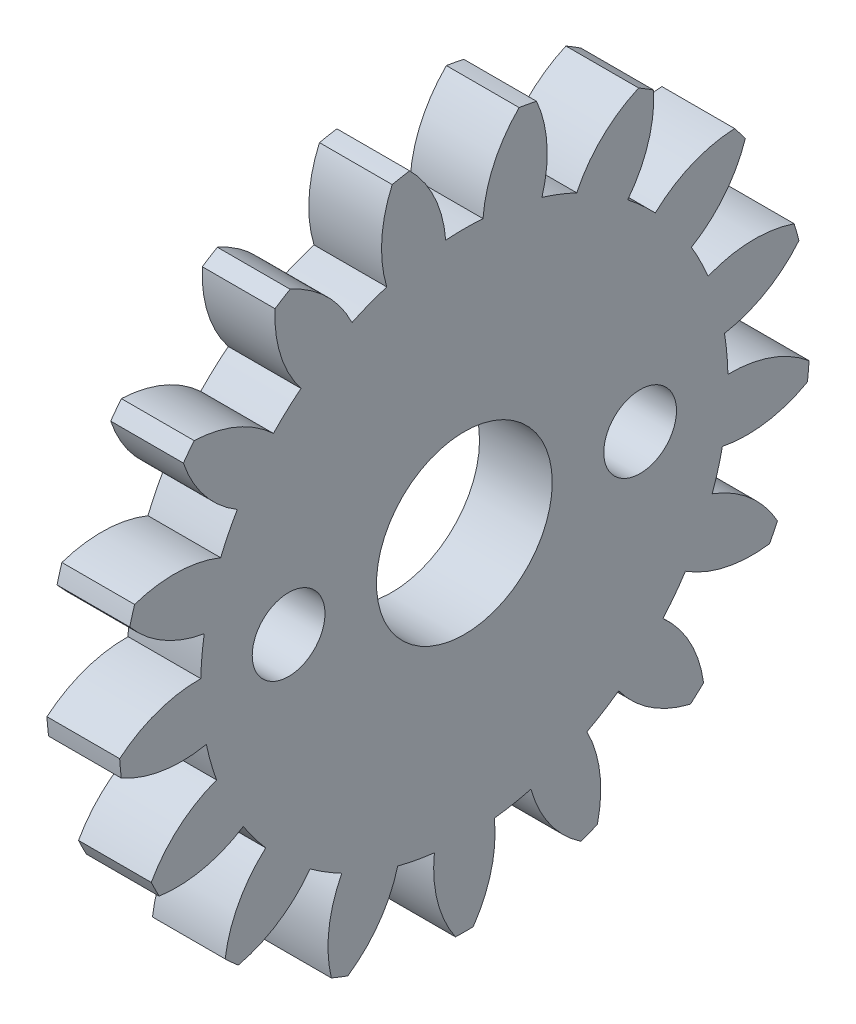
from build123d import *

# Parameters (mm, degrees)
BASPROSKE_W           = 3
BASPROSKE_H           = 14.25
TOOTHCUT_DEPTH        = 21.374616561
TEETHCUTS_COUNT       = 17
TEETHCUTS_ANGLE       = 338.823529412
BORSKE_R              = 2.5
BORE_DEPTH            = 50.0000508
CROQUIS1_R            = 1.5
CROQUIS1_R_2          = 3.625
CORTAR_EXTRUIR1_DEPTH = 10


with BuildPart() as part:
    # BasProSke → Base-Revolve (revolve)
    with BuildSketch(Plane(origin=(0, 0, 0), x_dir=(1, 0, 0), z_dir=(0, 1, 0)), mode=Mode.PRIVATE) as base_revolve_sk:
        with Locations((1.5, 7.125)):
            Rectangle(BASPROSKE_W, BASPROSKE_H)
    revolve(base_revolve_sk.sketch.rotate(Axis((-10, 0, 0), (1, 0, 0)), 180), axis=Axis((-10, 0, 0), (1, 0, 0)))

    # TooCutSke → ToothCut (cut, through all)
    with BuildSketch(Plane(origin=(0, 0, 0), x_dir=(0, 0, -1), z_dir=(1, 0, 0))):
        with BuildLine():
            ThreePointArc((0.769354207, 10.846749287), (0, 10.874), (-0.769354207, 10.846749287))
            ThreePointArc((-0.769354207, 10.846749287), (-1.230849554, 12.606357238), (-2.280560064, 14.092057726))
            ThreePointArc((-2.280560064, 14.092057726), (0, 14.2754), (2.280560064, 14.092057726))
            ThreePointArc((2.280560064, 14.092057726), (1.230849554, 12.606357238), (0.769354207, 10.846749287))
        make_face()
    toothcut = extrude(amount=TOOTHCUT_DEPTH, mode=Mode.SUBTRACT)

    # TeethCuts: ToothCut ×17 about axis
    teethcuts_axis = Axis((-10, 0, 0), (1, 0, 0))
    for i in range(1, TEETHCUTS_COUNT):
        add(toothcut.rotate(teethcuts_axis, i * TEETHCUTS_ANGLE / (TEETHCUTS_COUNT - 1)), mode=Mode.SUBTRACT)

    # BorSke → Bore (cut, symmetric)
    with BuildSketch(Plane(origin=(0, 0, 0), x_dir=(0, 0, -1), z_dir=(1, 0, 0))):
        with Locations(Location((0, 0, 0), (0, 0, 180))):
            Circle(BORSKE_R)
    extrude(amount=BORE_DEPTH, both=True, mode=Mode.SUBTRACT)

    # Croquis1 → Cortar-Extruir1 (cut)
    with BuildSketch(Plane(origin=(3, 0, 0), x_dir=(0, 0, -1), z_dir=(1, 0, 0))):
        with Locations((7.25, 0)):
            Circle(CROQUIS1_R)
        Circle(CROQUIS1_R_2)
        with Locations((-7.25, 0)):
            Circle(CROQUIS1_R)
    extrude(amount=-CORTAR_EXTRUIR1_DEPTH, mode=Mode.SUBTRACT)


solid = part.part
